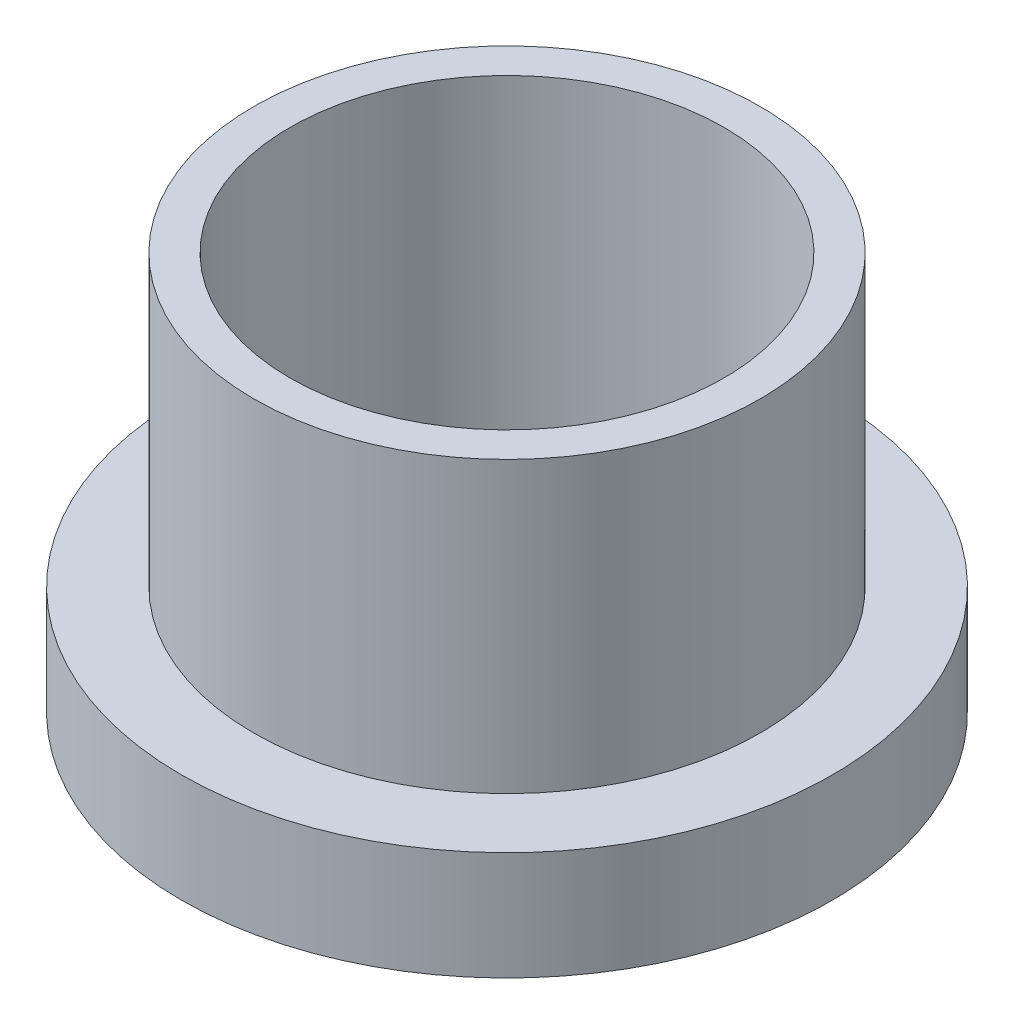
from build123d import *

# Parameters (mm, degrees)
SKETCH1_R           = 9
BOSS_EXTRUDE1_DEPTH = 3
SKETCH2_R           = 7
BOSS_EXTRUDE2_DEPTH = 8
SKETCH3_R           = 6
CUT_EXTRUDE1_DEPTH  = 17.822603841


with BuildPart() as part:
    # Sketch1 → Boss-Extrude1 (new body)
    with BuildSketch(Plane(origin=(0, 0, 0), x_dir=(1, 0, 0), z_dir=(0, 1, 0))):
        with Locations(Location((0, 0, 0), (0, 0, 270))):
            Circle(SKETCH1_R)
    extrude(amount=BOSS_EXTRUDE1_DEPTH)

    # Sketch2 → Boss-Extrude2 (add)
    with BuildSketch(Plane(origin=(0, 3, 0), x_dir=(1, 0, 0), z_dir=(0, 1, 0))):
        with Locations(Location((0, 0, 0), (0, 0, 270))):
            Circle(SKETCH2_R)
    extrude(amount=BOSS_EXTRUDE2_DEPTH)

    # Sketch3 → Cut-Extrude1 (cut, through all)
    with BuildSketch(Plane(origin=(0, 11, 0), x_dir=(1, 0, 0), z_dir=(0, 1, 0))):
        with Locations(Location((0, 0, 0), (0, 0, 270))):
            Circle(SKETCH3_R)
    extrude(amount=-CUT_EXTRUDE1_DEPTH, mode=Mode.SUBTRACT)


solid = part.part
